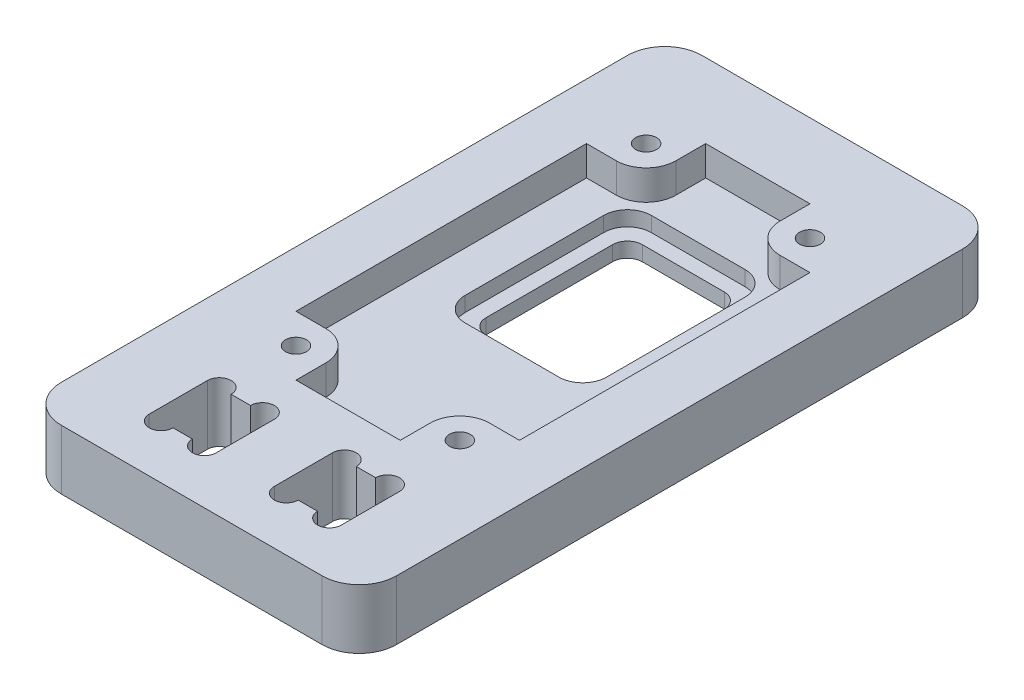
from build123d import *

# Parameters (mm, degrees)
BOSS_EXTRUDE1_DEPTH = 8
CUT_EXTRUDE1_START  = -4
SKETCH3_R           = 1.4
CUT_EXTRUDE1_DEPTH  = 4
CUT_EXTRUDE2_DEPTH  = 2


with BuildPart() as part:
    # Sketch1 → Boss-Extrude1 (new body)
    with BuildSketch(Plane(origin=(0, 0, 0), x_dir=(1, 0, 0), z_dir=(0, 1, 0))):
        with BuildLine():
            Line((25, 41), (-10, 41))
            ThreePointArc((-10, 41), (-13.535533906, 39.535533906), (-15, 36))
            Line((-15, 36), (-15, -40))
            ThreePointArc((-15, -40), (-13.535533906, -43.535533906), (-10, -45))
            Line((-10, -45), (25, -45))
            ThreePointArc((25, -45), (28.535533906, -43.535533906), (30, -40))
            Line((30, -40), (30, 36))
            ThreePointArc((30, 36), (28.535533906, 39.535533906), (25, 41))
        make_face()
        with BuildLine():
            Line((-5.4, -37.8), (-5.4, -30))
            ThreePointArc((-5.4, -30), (-3.8, -28.4), (-2.2, -30))
            Line((-2.2, -30), (0.4, -30))
            ThreePointArc((0.4, -30), (2, -28.4), (3.6, -30))
            Line((3.6, -30), (3.6, -37.8))
            ThreePointArc((3.6, -37.8), (2, -39.4), (0.4, -37.8))
            Line((0.4, -37.8), (-2.2, -37.8))
            ThreePointArc((-2.2, -37.8), (-3.8, -39.4), (-5.4, -37.8))
        make_face(mode=Mode.SUBTRACT)
        with BuildLine():
            Line((11.4, -37.8), (11.4, -30))
            ThreePointArc((11.4, -30), (13, -28.4), (14.6, -30))
            Line((14.6, -30), (17.2, -30))
            ThreePointArc((17.2, -30), (18.8, -28.4), (20.4, -30))
            Line((20.4, -30), (20.4, -37.8))
            ThreePointArc((20.4, -37.8), (18.8, -39.4), (17.2, -37.8))
            Line((17.2, -37.8), (14.6, -37.8))
            ThreePointArc((14.6, -37.8), (13, -39.4), (11.4, -37.8))
        make_face(mode=Mode.SUBTRACT)
        with BuildLine():
            Line((13, 0), (2, 0))
            ThreePointArc((2, 0), (0.585786438, 0.585786438), (0, 2))
            Line((0, 2), (0, 19))
            ThreePointArc((0, 19), (0.585786438, 20.414213562), (2, 21))
            Line((2, 21), (13, 21))
            ThreePointArc((13, 21), (14.414213562, 20.414213562), (15, 19))
            Line((15, 19), (15, 2))
            ThreePointArc((15, 2), (14.414213562, 0.585786438), (13, 0))
        make_face(mode=Mode.SUBTRACT)
    extrude(amount=BOSS_EXTRUDE1_DEPTH)

    # Sketch3 → Cut-Extrude1 (cut)
    # profile 1 of 5: a face of its own
    with BuildSketch(Plane(origin=(0, 8, 0), x_dir=(1, 0, 0), z_dir=(0, 1, 0)).offset(CUT_EXTRUDE1_START)):
        with BuildLine():
            Line((14.5, 31), (0.5, 31))
            Line((0.5, 31), (0.5, 27))
            ThreePointArc((0.5, 27), (-0.671572875, 24.171572875), (-3.5, 23))
            Line((-3.5, 23), (-7.5, 23))
            Line((-7.5, 23), (-7.5, -16))
            Line((-7.5, -16), (-3.5, -16))
            ThreePointArc((-3.5, -16), (-0.671572875, -17.171572875), (0.5, -20))
            Line((0.5, -20), (0.5, -24))
            Line((0.5, -24), (14.5, -24))
            Line((14.5, -24), (14.5, -20))
            ThreePointArc((14.5, -20), (15.671572875, -17.171572875), (18.5, -16))
            Line((18.5, -16), (22.5, -16))
            Line((22.5, -16), (22.5, 23))
            Line((22.5, 23), (18.5, 23))
            ThreePointArc((18.5, 23), (15.671572875, 24.171572875), (14.5, 27))
            Line((14.5, 27), (14.5, 31))
        make_face()
        with BuildLine():
            ThreePointArc((13, 21), (14.414213562, 20.414213562), (15, 19))
            Line((15, 19), (15, 2))
            ThreePointArc((15, 2), (14.414213562, 0.585786438), (13, 0))
            Line((13, 0), (2, 0))
            ThreePointArc((2, 0), (0.585786438, 0.585786438), (0, 2))
            Line((0, 2), (0, 19))
            ThreePointArc((0, 19), (0.585786438, 20.414213562), (2, 21))
            Line((2, 21), (13, 21))
        make_face(mode=Mode.SUBTRACT)
    # profile 2 of 5: a face of its own
    with BuildSketch(Plane(origin=(0, 8, 0), x_dir=(1, 0, 0), z_dir=(0, 1, 0)).offset(CUT_EXTRUDE1_START)):
        with Locations(Location((-3.5, 27, 0), (0, 0, 270))):
            Circle(SKETCH3_R)
    # profile 3 of 5: a face of its own
    with BuildSketch(Plane(origin=(0, 8, 0), x_dir=(1, 0, 0), z_dir=(0, 1, 0)).offset(CUT_EXTRUDE1_START)):
        with Locations(Location((18.5, 27, 0), (0, 0, 270))):
            Circle(SKETCH3_R)
    # profile 4 of 5: a face of its own
    with BuildSketch(Plane(origin=(0, 8, 0), x_dir=(1, 0, 0), z_dir=(0, 1, 0)).offset(CUT_EXTRUDE1_START)):
        with Locations(Location((-3.5, -20, 0), (0, 0, 270))):
            Circle(SKETCH3_R)
    # profile 5 of 5: a face of its own
    with BuildSketch(Plane(origin=(0, 8, 0), x_dir=(1, 0, 0), z_dir=(0, 1, 0)).offset(CUT_EXTRUDE1_START)):
        with Locations(Location((18.5, -20, 0), (0, 0, 270))):
            Circle(SKETCH3_R)
    extrude(amount=CUT_EXTRUDE1_DEPTH, mode=Mode.SUBTRACT)

    # Sketch5 → Cut-Extrude2 (cut)
    with BuildSketch(Plane(origin=(0, 4, 0), x_dir=(1, 0, 0), z_dir=(0, 1, 0))):
        with BuildLine():
            Line((1.2, -2), (13.8, -2))
            ThreePointArc((13.8, -2), (16.0627417, -1.0627417), (17, 1.2))
            Line((17, 1.2), (17, 19.8))
            ThreePointArc((17, 19.8), (16.0627417, 22.0627417), (13.8, 23))
            Line((13.8, 23), (1.2, 23))
            ThreePointArc((1.2, 23), (-1.0627417, 22.0627417), (-2, 19.8))
            Line((-2, 19.8), (-2, 1.2))
            ThreePointArc((-2, 1.2), (-1.0627417, -1.0627417), (1.2, -2))
        make_face()
    extrude(amount=-CUT_EXTRUDE2_DEPTH, mode=Mode.SUBTRACT)


solid = part.part
